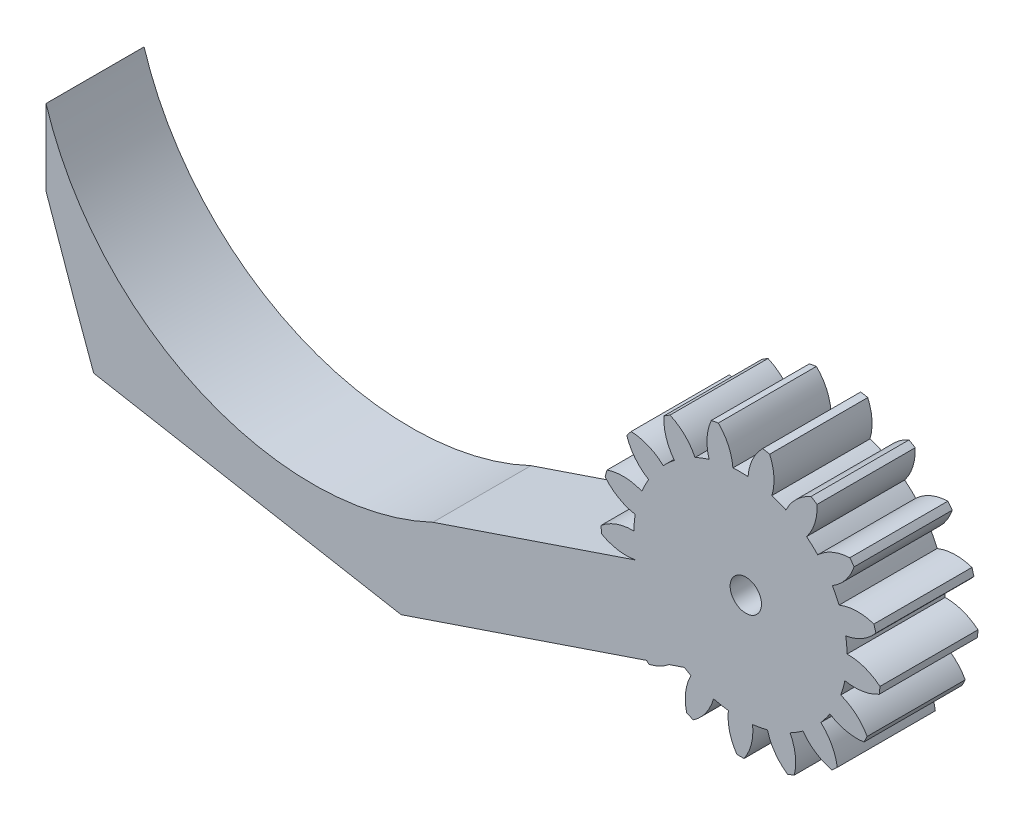
from build123d import *

# Parameters (mm, degrees)
EXTRUDE_1_DEPTH     = 10
SKETCH_2_R          = 1.6
CUT_EXTRUDE_1_DEPTH = 10
EXTRUDE_2_DEPTH     = 10


with BuildPart() as part:
    # 草图1 → 凸台-拉伸1 (new body)
    with BuildSketch(Plane.XY):
        with BuildLine():
            ThreePointArc((-14.346020253, 3.273810573), (-12.969870434, 2.10791515), (-11.273952779, 1.493941396))
            ThreePointArc((-11.273952779, 1.493941396), (-11.372074296, 0.730383496), (-11.41592688, -0.03820316))
            ThreePointArc((-11.41592688, -0.03820316), (-13.195785695, -0.330098793), (-14.762736671, -1.223275765))
            ThreePointArc((-14.762736671, -1.223275765), (-14.733672875, -1.587766767), (-14.695266759, -1.951392075))
            ThreePointArc((-14.695266759, -1.951392075), (-12.990875263, -2.541434526), (-11.187686245, -2.501311882))
            ThreePointArc((-11.187686245, -2.501311882), (-11.003352906, -3.248753999), (-10.766598699, -3.981281092))
            ThreePointArc((-10.766598699, -3.981281092), (-12.320822752, -4.896424828), (-13.459308284, -6.295335531))
            ThreePointArc((-13.459308284, -6.295335531), (-13.300537764, -6.624714214), (-13.133368515, -6.949910827))
            ThreePointArc((-13.133368515, -6.949910827), (-11.33092286, -6.884411803), (-9.663993147, -6.195611546))
            ThreePointArc((-9.663993147, -6.195611546), (-9.222100192, -6.825991681), (-8.736714161, -7.423527369))
            ThreePointArc((-8.736714161, -7.423527369), (-9.855396881, -8.838323974), (-10.411658189, -10.554037767))
            ThreePointArc((-10.411658189, -10.554037767), (-10.144623785, -10.803819715), (-9.871268536, -11.046668027))
            ThreePointArc((-9.871268536, -11.046668027), (-8.214198994, -10.334473534), (-6.908656681, -9.090021956))
            ThreePointArc((-6.908656681, -9.090021956), (-6.268884202, -9.518203778), (-5.600420419, -9.900047555))
            ThreePointArc((-5.600420419, -9.900047555), (-6.132477506, -11.62342091), (-6.031388419, -13.424221137))
            ThreePointArc((-6.031388419, -13.424221137), (-5.692154606, -13.560671914), (-5.349531499, -13.688373915))
            ThreePointArc((-5.349531499, -13.688373915), (-4.061634494, -12.425669766), (-3.293800304, -10.793636948))
            ThreePointArc((-3.293800304, -10.793636948), (-2.542553119, -10.96179213), (-1.781291324, -11.076373878))
            ThreePointArc((-1.781291324, -11.076373878), (-1.65486552, -12.87557286), (-0.910078679, -14.518251473))
            ThreePointArc((-0.910078679, -14.518251473), (-0.544460863, -14.522942645), (-0.178843046, -14.518251473))
            ThreePointArc((-0.178843046, -14.518251473), (0.565943794, -12.87557286), (0.692369599, -11.076373878))
            ThreePointArc((0.692369599, -11.076373878), (1.453631394, -10.96179213), (2.204878579, -10.793636948))
            ThreePointArc((2.204878579, -10.793636948), (2.972712769, -12.425669766), (4.260609774, -13.688373915))
            ThreePointArc((4.260609774, -13.688373915), (4.603232881, -13.560671914), (4.942466694, -13.424221137))
            ThreePointArc((4.942466694, -13.424221137), (5.043555781, -11.62342091), (4.511498694, -9.900047555))
            ThreePointArc((4.511498694, -9.900047555), (5.179962477, -9.518203778), (5.819734956, -9.090021956))
            ThreePointArc((5.819734956, -9.090021956), (7.125277269, -10.334473534), (8.782346811, -11.046668027))
            ThreePointArc((8.782346811, -11.046668027), (9.055702059, -10.803819715), (9.322736464, -10.554037767))
            ThreePointArc((9.322736464, -10.554037767), (8.766475155, -8.838323974), (7.647792436, -7.423527369))
            ThreePointArc((7.647792436, -7.423527369), (8.133178467, -6.825991681), (8.575071422, -6.195611546))
            ThreePointArc((8.575071422, -6.195611546), (10.242001135, -6.884411803), (12.04444679, -6.949910827))
            ThreePointArc((12.04444679, -6.949910827), (12.211616039, -6.624714214), (12.370386559, -6.295335531))
            ThreePointArc((12.370386559, -6.295335531), (11.231901027, -4.896424828), (9.677676974, -3.981281092))
            ThreePointArc((9.677676974, -3.981281092), (9.914431181, -3.248753999), (10.09876452, -2.501311882))
            ThreePointArc((10.09876452, -2.501311882), (11.901953538, -2.541434526), (13.606345034, -1.951392075))
            ThreePointArc((13.606345034, -1.951392075), (13.64475115, -1.587766767), (13.673814946, -1.223275765))
            ThreePointArc((13.673814946, -1.223275765), (12.10686397, -0.330098793), (10.327005155, -0.03820316))
            ThreePointArc((10.327005155, -0.03820316), (10.28315257, 0.730383496), (10.185031054, 1.493941396))
            ThreePointArc((10.185031054, 1.493941396), (11.880948709, 2.10791515), (13.257098528, 3.273810573))
            ThreePointArc((13.257098528, 3.273810573), (13.161554553, 3.626754964), (13.056986399, 3.977131755))
            ThreePointArc((13.056986399, 3.977131755), (11.273195392, 4.243946496), (9.50808161, 3.873171904))
            ThreePointArc((9.50808161, 3.873171904), (9.189544768, 4.574016236), (8.822220251, 5.250567193))
            ThreePointArc((8.822220251, 5.250567193), (10.181823465, 6.435716787), (11.04387495, 8.020004545))
            ThreePointArc((11.04387495, 8.020004545), (10.827284626, 8.314600924), (10.603207031, 8.603543177))
            ThreePointArc((10.603207031, 8.603543177), (8.843486852, 8.207960878), (7.3315065, 7.224591224))
            ThreePointArc((7.3315065, 7.224591224), (6.781305566, 7.763040321), (6.19438726, 8.26121238))
            ThreePointArc((6.19438726, 8.26121238), (7.034054087, 9.857476795), (7.265582407, 11.646190047))
            ThreePointArc((7.265582407, 11.646190047), (6.957197458, 11.84265154), (6.643873342, 12.031136003))
            ThreePointArc((6.643873342, 12.031136003), (5.145883953, 11.026582245), (4.091238356, 9.563427049))
            ThreePointArc((4.091238356, 9.563427049), (3.383681016, 9.866760378), (2.65643549, 10.119272641))
            ThreePointArc((2.65643549, 10.119272641), (2.86276427, 11.911067522), (2.432500244, 13.662630633))
            ThreePointArc((2.432500244, 13.662630633), (2.073969766, 13.734424026), (1.713715288, 13.796994828))
            ThreePointArc((1.713715288, 13.796994828), (0.679768455, 12.319140163), (0.224893345, 10.573806643))
            ThreePointArc((0.224893345, 10.573806643), (-0.544460863, 10.601057355), (-1.31381507, 10.573806643))
            ThreePointArc((-1.31381507, 10.573806643), (-1.76869018, 12.319140163), (-2.802637013, 13.796994828))
            ThreePointArc((-2.802637013, 13.796994828), (-3.162891491, 13.734424026), (-3.521421969, 13.662630633))
            ThreePointArc((-3.521421969, 13.662630633), (-3.951685995, 11.911067522), (-3.745357215, 10.119272641))
            ThreePointArc((-3.745357215, 10.119272641), (-4.472602741, 9.866760378), (-5.180160081, 9.563427049))
            ThreePointArc((-5.180160081, 9.563427049), (-6.234805678, 11.026582245), (-7.732795067, 12.031136003))
            ThreePointArc((-7.732795067, 12.031136003), (-8.046119184, 11.84265154), (-8.354504132, 11.646190047))
            ThreePointArc((-8.354504132, 11.646190047), (-8.122975812, 9.857476795), (-7.283308985, 8.26121238))
            ThreePointArc((-7.283308985, 8.26121238), (-7.870227292, 7.763040321), (-8.420428225, 7.224591224))
            ThreePointArc((-8.420428225, 7.224591224), (-9.932408577, 8.207960878), (-11.692128756, 8.603543177))
            ThreePointArc((-11.692128756, 8.603543177), (-11.916206351, 8.314600924), (-12.132796675, 8.020004545))
            ThreePointArc((-12.132796675, 8.020004545), (-11.27074519, 6.435716787), (-9.911141976, 5.250567193))
            ThreePointArc((-9.911141976, 5.250567193), (-10.278466493, 4.574016236), (-10.597003335, 3.873171904))
            ThreePointArc((-10.597003335, 3.873171904), (-12.362117117, 4.243946496), (-14.145908124, 3.977131755))
            ThreePointArc((-14.145908124, 3.977131755), (-14.250476278, 3.626754964), (-14.346020253, 3.273810573))
        make_face()
    extrude(amount=EXTRUDE_1_DEPTH)

    # 草图2 → 切除-拉伸1 (cut)
    with BuildSketch(Plane.XY.offset(10)):
        Circle(SKETCH_2_R)
    extrude(amount=-CUT_EXTRUDE_1_DEPTH, mode=Mode.SUBTRACT)

    # 草图3 → 凸台-拉伸2 (add)
    with BuildSketch(Plane.XY.offset(10)):
        with BuildLine():
            Line((-35.145602395, -19.299750751), (-6.268884202, -9.518203778))
            Line((-6.268884202, -9.518203778), (-11.187686245, -2.501311882))
            Line((-11.187686245, -2.501311882), (-31.902692825, -9.518203778))
            ThreePointArc((-31.902692825, -9.518203778), (-55.564328736, -9.890192083), (-71.354077075, 7.736357117))
            Line((-71.354077075, 7.736357117), (-71.354077075, 0))
            Line((-71.354077075, 0), (-68.451868042, -8.25925779))
            Line((-68.451868042, -8.25925779), (-66.492126744, -13.648546361))
            Line((-66.492126744, -13.648546361), (-35.145602395, -19.299750751))
        make_face()
    extrude(amount=-EXTRUDE_2_DEPTH)


solid = part.part
